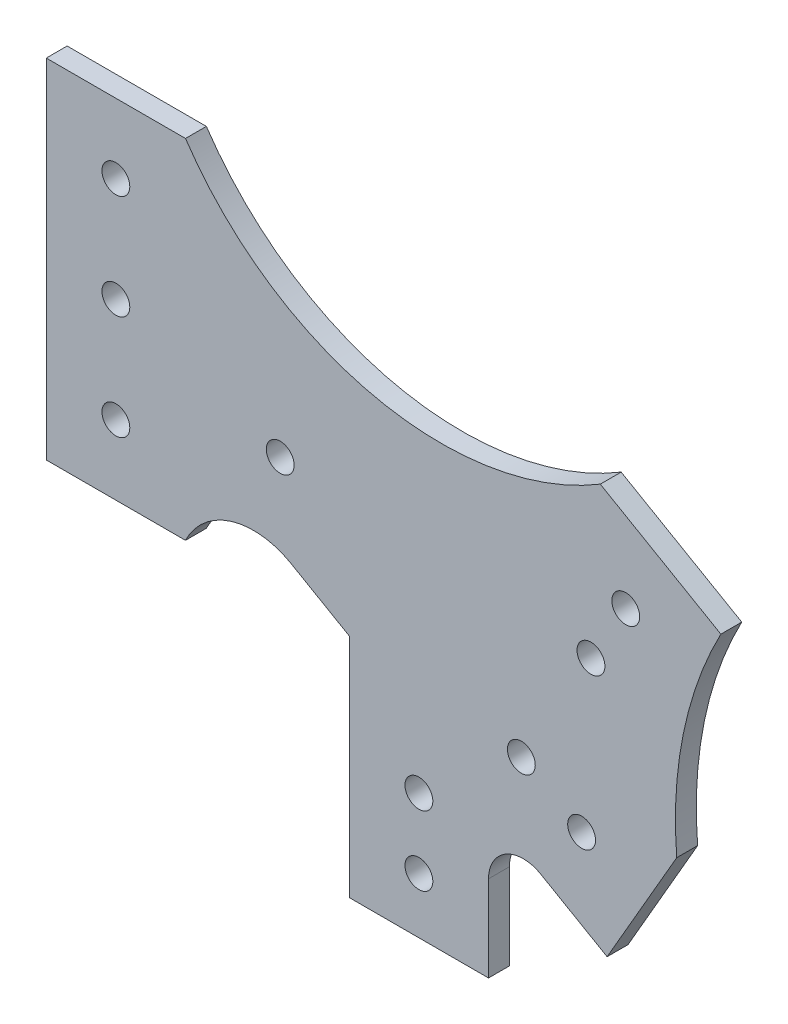
from build123d import *

# Parameters (mm, degrees)
SKETCH_1_R      = 2
EXTRUDE_1_DEPTH = 3


with BuildPart() as part:
    # 草图1 → 凸台-拉伸1 (new body)
    with BuildSketch(Plane.XY):
        with BuildLine():
            Line((47.983882687, 10.173144913), (30.663374611, 20.173144913))
            ThreePointArc((30.663374611, 20.173144913), (-1.771986525, 14.862979702), (-28.921960456, 33.386732619))
            Line((-28.921960456, 33.386732619), (-48.921960456, 33.386732619))
            Line((-48.921960456, 33.386732619), (-48.921960456, -16.613267381))
            Line((-48.921960456, -16.613267381), (-28.921960456, -16.613267381))
            ThreePointArc((-28.921960456, -16.613267381), (-22.343103236, -10.961079821), (-13.724464148, -11.93455135))
            Line((-13.724464148, -11.93455135), (-5.391960456, -16.745324599))
            Line((-5.391960456, -16.745324599), (-5.391960456, -49.292329983))
            Line((-5.391960456, -49.292329983), (14.608039544, -49.292329983))
            Line((14.608039544, -49.292329983), (14.608039544, -36.952584021))
            ThreePointArc((14.608039544, -36.952584021), (17.108039544, -32.622457002), (22.108039544, -32.622457002))
            Line((22.108039544, -32.622457002), (31.644136725, -38.128125276))
            Line((31.644136725, -38.128125276), (41.644136725, -20.8076172))
            ThreePointArc((41.644136725, -20.8076172), (42.599829652, -4.864137572), (47.983882687, 10.173144913))
        make_face()
        with Locations((-38.921960456, 23.386732619)):
            Circle(SKETCH_1_R, mode=Mode.SUBTRACT)
        with Locations((-38.921960456, 8.386732619)):
            Circle(SKETCH_1_R, mode=Mode.SUBTRACT)
        with Locations((-38.921960456, -6.613267381)):
            Circle(SKETCH_1_R, mode=Mode.SUBTRACT)
        with Locations((-15.317387503, 0.532128762)):
            Circle(SKETCH_1_R, mode=Mode.SUBTRACT)
        with Locations((34.323628649, 6.512890875)):
            Circle(SKETCH_1_R, mode=Mode.SUBTRACT)
        with Locations((29.323628649, -2.147363162)):
            Circle(SKETCH_1_R, mode=Mode.SUBTRACT)
        with Locations((19.323628649, -19.467871238)):
            Circle(SKETCH_1_R, mode=Mode.SUBTRACT)
        with Locations((27.983882687, -24.467871238)):
            Circle(SKETCH_1_R, mode=Mode.SUBTRACT)
        with Locations((4.608039544, -31.292329983)):
            Circle(SKETCH_1_R, mode=Mode.SUBTRACT)
        with Locations((4.608039544, -41.292329983)):
            Circle(SKETCH_1_R, mode=Mode.SUBTRACT)
    extrude(amount=EXTRUDE_1_DEPTH)


solid = part.part
